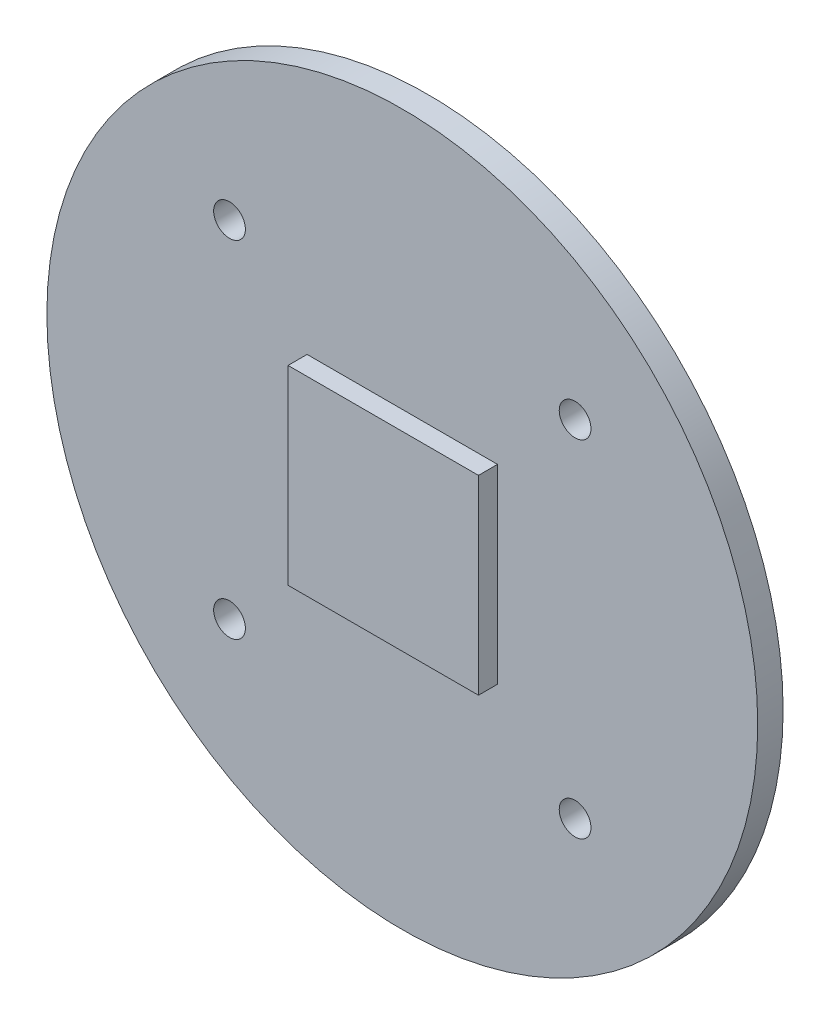
from build123d import *

# Parameters (mm, degrees)
SKETCH_1_R          = 28
EXTRUDE_1_DEPTH     = 2
SKETCH_2_W          = 15
SKETCH_2_H          = 15
EXTRUDE_2_DEPTH     = 1.5
SKETCH_4_W          = 10
SKETCH_4_H          = 20
EXTRUDE_3_DEPTH     = 1.5
SKETCH_5_W          = 15
SKETCH_5_H          = 15
EXTRUDE_4_DEPTH     = 1.5
CUT_EXTRUDE_1_DEPTH = 10


with BuildPart() as part:
    # 草图1 → 凸台-拉伸1 (new body)
    with BuildSketch(Plane.XY):
        Circle(SKETCH_1_R)
    extrude(amount=EXTRUDE_1_DEPTH)

    # 草图2 → 凸台-拉伸2 (add)
    with BuildSketch(Plane.XY.offset(2)):
        Rectangle(SKETCH_2_W, SKETCH_2_H)
    extrude(amount=EXTRUDE_2_DEPTH)

    # 草图4 → 凸台-拉伸3 (add)
    with BuildSketch(Plane(origin=(0, 0, 0), x_dir=(-1, 0, 0), z_dir=(0, 0, -1))):
        with Locations((19, 0)):
            Rectangle(SKETCH_4_W, SKETCH_4_H)
    extrude(amount=EXTRUDE_3_DEPTH)

    # 草图5 → 凸台-拉伸4 (add)
    with BuildSketch(Plane(origin=(0, 0, 0), x_dir=(-1, 0, 0), z_dir=(0, 0, -1))):
        Rectangle(SKETCH_5_W, SKETCH_5_H)
    extrude(amount=EXTRUDE_4_DEPTH)

    # 草图6 → 切除-拉伸1 (cut)
    with BuildSketch(Plane(origin=(0, 0, 0), x_dir=(-1, 0, 0), z_dir=(0, 0, -1))):
        with BuildLine():
            ThreePointArc((-14.495689014, 14.495689014), (-14.495689014, 12.727922061), (-12.727922061, 12.727922061))
            Line((-12.727922061, 12.727922061), (-14.495689014, 14.495689014))
        make_face()
        with BuildLine():
            Line((-14.495689014, 14.495689014), (-12.727922061, 12.727922061))
            ThreePointArc((-12.727922061, 12.727922061), (-12.456956122, 13.133451247), (-12.361805538, 13.611805538))
            ThreePointArc((-12.361805538, 13.611805538), (-13.133451247, 14.766654953), (-14.495689014, 14.495689014))
        make_face()
        with BuildLine():
            ThreePointArc((-12.361805538, -13.611805538), (-12.456956122, -13.133451247), (-12.727922061, -12.727922061))
            Line((-12.727922061, -12.727922061), (-14.495689014, -14.495689014))
            ThreePointArc((-14.495689014, -14.495689014), (-13.133451247, -14.766654953), (-12.361805538, -13.611805538))
        make_face()
        with BuildLine():
            Line((-14.495689014, -14.495689014), (-12.727922061, -12.727922061))
            ThreePointArc((-12.727922061, -12.727922061), (-14.495689014, -12.727922061), (-14.495689014, -14.495689014))
        make_face()
        with BuildLine():
            ThreePointArc((14.861805538, -13.611805538), (14.090159828, -12.456956122), (12.727922061, -12.727922061))
            Line((12.727922061, -12.727922061), (14.495689014, -14.495689014))
            ThreePointArc((14.495689014, -14.495689014), (14.766654953, -14.090159828), (14.861805538, -13.611805538))
        make_face()
        with BuildLine():
            Line((14.495689014, -14.495689014), (12.727922061, -12.727922061))
            ThreePointArc((12.727922061, -12.727922061), (12.727922061, -14.495689014), (14.495689014, -14.495689014))
        make_face()
        with BuildLine():
            ThreePointArc((14.495689014, 14.495689014), (12.727922061, 14.495689014), (12.727922061, 12.727922061))
            Line((12.727922061, 12.727922061), (14.495689014, 14.495689014))
        make_face()
        with BuildLine():
            Line((14.495689014, 14.495689014), (12.727922061, 12.727922061))
            ThreePointArc((12.727922061, 12.727922061), (14.090159828, 12.456956122), (14.861805538, 13.611805538))
            ThreePointArc((14.861805538, 13.611805538), (14.766654953, 14.090159828), (14.495689014, 14.495689014))
        make_face()
    extrude(amount=-CUT_EXTRUDE_1_DEPTH, mode=Mode.SUBTRACT)


solid = part.part
